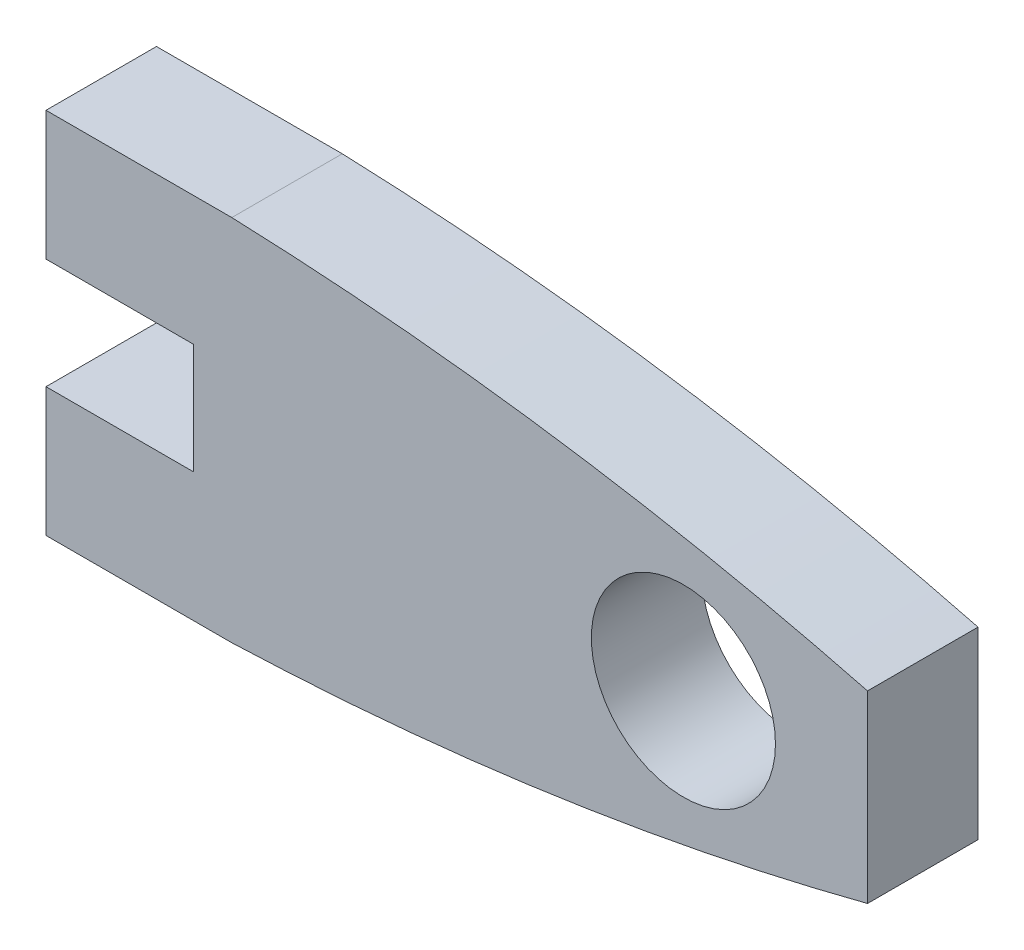
from build123d import *

# Parameters (mm, degrees)
SKETCH1_R           = 2.5
BOSS_EXTRUDE1_DEPTH = 3
SKETCH2_W           = 5
SKETCH2_H           = 1
BOSS_EXTRUDE2_DEPTH = 3
CUT_EXTRUDE1_REACH  = 15.032
SKETCH3_W           = 1
SKETCH3_H           = 3.5


with BuildPart() as part:
    # Sketch1 → Boss-Extrude1 (new body)
    with BuildSketch(Plane.XY):
        with BuildLine():
            Line((-6.654411765, -2.5), (-11.654411765, -2.5))
            Line((-11.654411765, -2.5), (-11.654411765, -5))
            Line((-11.654411765, -5), (-5.608785246, -5))
            add(Edge.make_bspline(
                [(-5.608785246, -5), (3.217675956, -4.682890968), (11.654411765, -2.5)],
                knots=[0.187203543, 0.187203543, 0.187203543, 0.737930507, 0.737930507, 0.737930507], degree=2))
            Line((11.654411765, -2.5), (11.654411765, 2.5))
            add(Edge.make_bspline(
                [(-5.608785246, 5), (3.217675956, 4.682890968), (11.654411765, 2.5)],
                knots=[0.187203543, 0.187203543, 0.187203543, 0.737930507, 0.737930507, 0.737930507], degree=2))
            Line((-5.608785246, 5), (-11.654411765, 5))
            Line((-11.654411765, 5), (-11.654411765, 2.5))
            Line((-11.654411765, 2.5), (-6.654411765, 2.5))
            Line((-6.654411765, 2.5), (-6.654411765, -2.5))
        make_face()
        with Locations((6.654411765, 0)):
            Circle(SKETCH1_R, mode=Mode.SUBTRACT)
    extrude(amount=BOSS_EXTRUDE1_DEPTH)

    # Sketch2 → Boss-Extrude2 (add)
    with BuildSketch(Plane.XY.offset(3)):
        with Locations((-9.154411765, 2)):
            Rectangle(SKETCH2_W, SKETCH2_H)
        with Locations((-9.154411765, -2)):
            Rectangle(SKETCH2_W, SKETCH2_H)
    extrude(amount=-BOSS_EXTRUDE2_DEPTH)

    # Sketch3 → Cut-Extrude1 (cut, up to next)
    with BuildSketch(Plane.XY.offset(3), mode=Mode.PRIVATE) as cut_extrude1_sk1:
        with Locations((-11.154411765, 3.25)):
            Rectangle(SKETCH3_W, SKETCH3_H)
    cut_extrude1_tool1 = extrude(cut_extrude1_sk1.sketch, amount=-CUT_EXTRUDE1_REACH, mode=Mode.PRIVATE) & part.part
    # Sketch3 → Cut-Extrude1 (cut, up to next)
    with BuildSketch(Plane.XY.offset(3), mode=Mode.PRIVATE) as cut_extrude1_sk2:
        with Locations((-11.154411765, -3.25)):
            Rectangle(SKETCH3_W, SKETCH3_H)
    cut_extrude1_tool2 = extrude(cut_extrude1_sk2.sketch, amount=-CUT_EXTRUDE1_REACH, mode=Mode.PRIVATE) & part.part
    add(cut_extrude1_tool1.solids().sort_by_distance((-11.154412, 3.25, 3))[0], mode=Mode.SUBTRACT)
    add(cut_extrude1_tool2.solids().sort_by_distance((-11.154412, -3.25, 3))[0], mode=Mode.SUBTRACT)


solid = part.part
